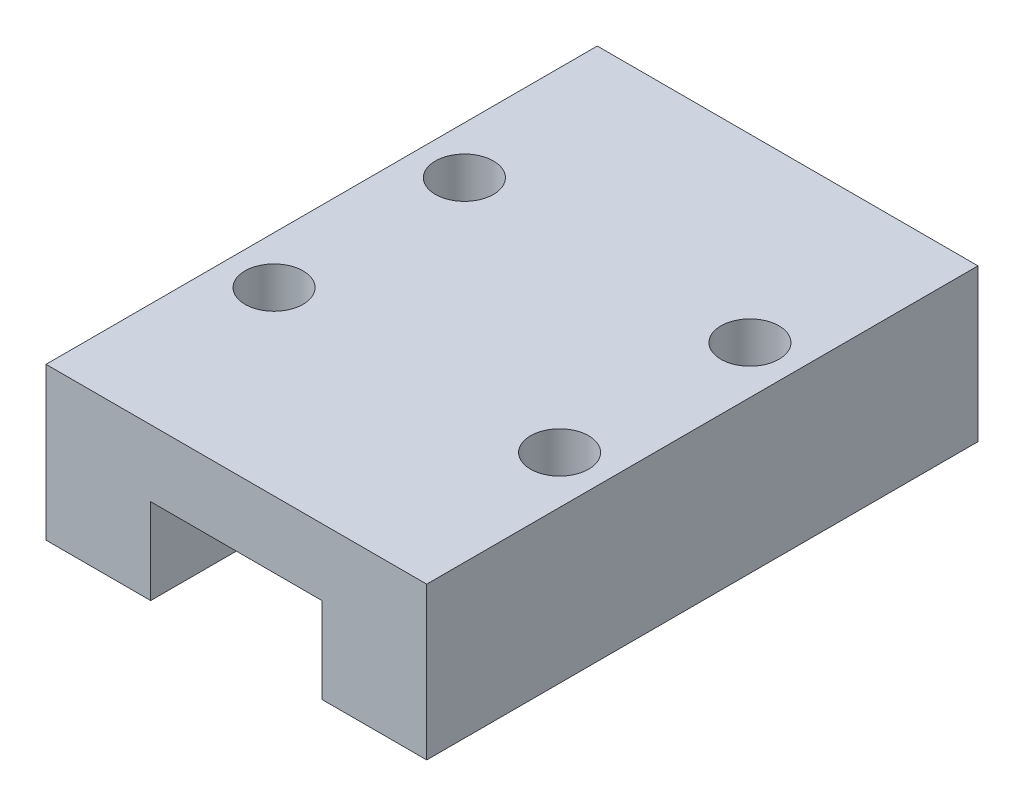
from build123d import *

# Parameters (mm, degrees)
EXTRUDE_1_DEPTH     = 28.96
SKETCH_2_R          = 1.525
CUT_EXTRUDE_1_DEPTH = 3


with BuildPart() as part:
    # 草图1 → 凸台-拉伸1 (new body)
    with BuildSketch(Plane.XY):
        Polygon((-10, 8), (10, 8), (10, 0), (4.5, 0), (4.5, 4.5), (-4.5, 4.5), (-4.5, 0), (-10, 0), align=None)
    extrude(amount=EXTRUDE_1_DEPTH)

    # 草图2 → 切除-拉伸1 (cut)
    with BuildSketch(Plane(origin=(0, 8, 0), x_dir=(1, 0, 0), z_dir=(0, 1, 0))):
        with Locations(Location((7.5, -9.48, 0), (0, 0, 180))):
            Circle(SKETCH_2_R)
        with Locations((7.5, -19.48)):
            Circle(SKETCH_2_R)
        with Locations(Location((-7.5, -19.48, 0), (0, 0, 180))):
            Circle(SKETCH_2_R)
        with Locations((-7.5, -9.48)):
            Circle(SKETCH_2_R)
    extrude(amount=-CUT_EXTRUDE_1_DEPTH, mode=Mode.SUBTRACT)


solid = part.part
